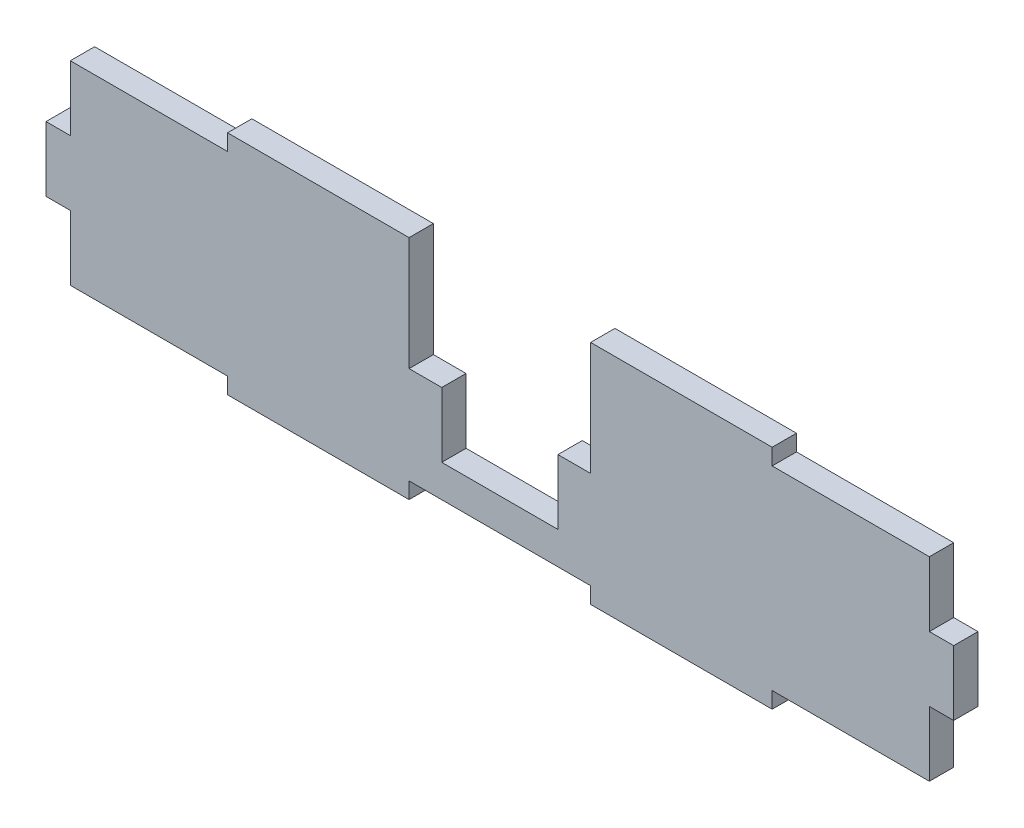
from build123d import *

# Parameters (mm, degrees)
BOSS_EXTRUDE1_DEPTH = 9.525


with BuildPart() as part:
    # Sketch1 → Boss-Extrude1 (new body)
    with BuildSketch(Plane.XY):
        Polygon((207.416291055, 18.582047585), (207.416291055, 43.982047585), (145.821291055, 43.982047585), (145.821291055, 50.332047585), (74.701291055, 50.332047585), (74.701291055, 5.882047585), (61.900003591, 5.882047585), (61.900003591, -19.517952415), (16.38257852, -19.517952415), (16.38257852, 5.882047585), (3.581291055, 5.882047585), (3.581291055, 50.332047585), (-67.538708945, 50.332047585), (-67.538708945, 43.982047585), (-129.133708945, 43.982047585), (-129.133708945, 18.582047585), (-138.658708945, 18.582047585), (-138.658708945, -6.817952415), (-129.133708945, -6.817952415), (-129.133708945, -32.217952415), (-67.538708945, -32.217952415), (-67.538708945, -38.567952415), (3.581291055, -38.567952415), (3.581291055, -32.217952415), (74.701291055, -32.217952415), (74.701291055, -38.567952415), (145.821291055, -38.567952415), (145.821291055, -32.217952415), (207.416291055, -32.217952415), (207.416291055, -6.817952415), (216.941291055, -6.817952415), (216.941291055, 18.582047585), align=None)
    extrude(amount=BOSS_EXTRUDE1_DEPTH)


solid = part.part
